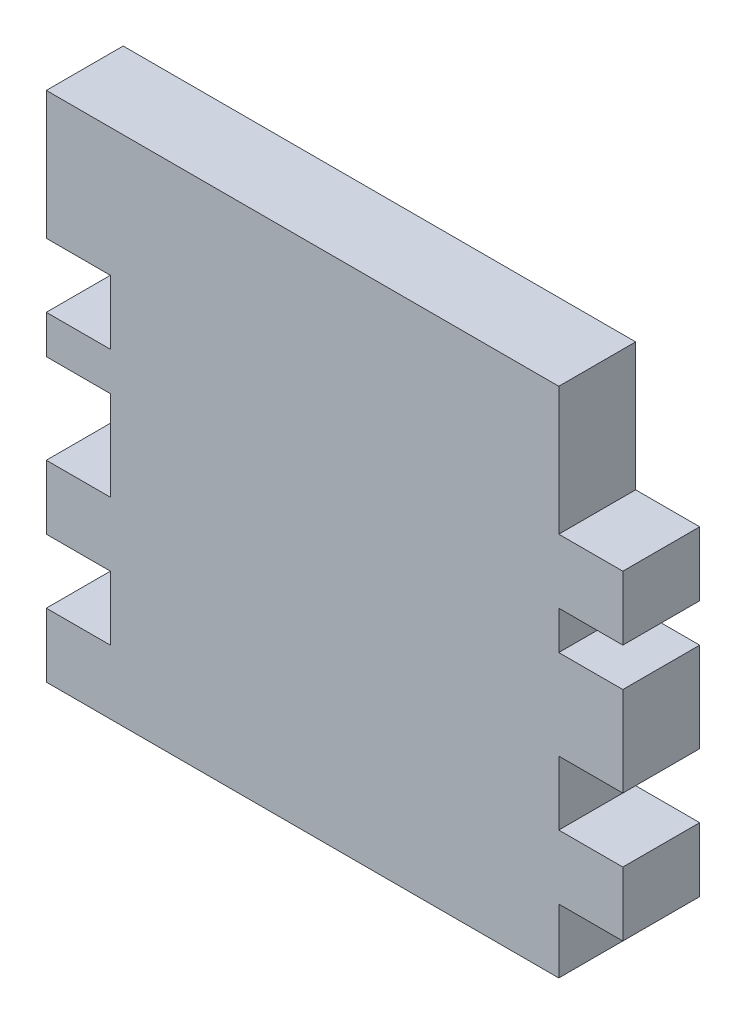
from build123d import *

# Parameters (mm, degrees)
SKETCH1_W           = 45
SKETCH1_H           = 40
BOSS_EXTRUDE1_DEPTH = 6
SKETCH2_W           = 5
SKETCH2_H           = 5
SKETCH2_H_2         = 7
CUT_EXTRUDE1_DEPTH  = 6
SKETCH3_W           = 5
SKETCH3_H           = 5
SKETCH3_H_2         = 7
CUT_EXTRUDE3_DEPTH  = 6
SKETCH3_4_W         = 5
SKETCH3_4_H         = 5
SKETCH3_4_H_2       = 7
BOSS_EXTRUDE3_DEPTH = 6
SKETCH3_5_W         = 5
SKETCH3_5_H         = 10
SKETCH3_5_H_2       = 3
SKETCH3_5_H_3       = 5
CUT_EXTRUDE4_DEPTH  = 6
SKETCH4_W           = 5
SKETCH4_H           = 2
CUT_EXTRUDE10_DEPTH = 10
SKETCH5_W           = 5
SKETCH5_H           = 5
BOSS_EXTRUDE4_DEPTH = 6


with BuildPart() as part:
    # Sketch1 → Boss-Extrude1 (new body)
    with BuildSketch(Plane.XY):
        with Locations((4.06626506, -2.515060241)):
            Rectangle(SKETCH1_W, SKETCH1_H)
    extrude(amount=BOSS_EXTRUDE1_DEPTH)

    # Sketch2 → Cut-Extrude1 (cut)
    with BuildSketch(Plane.XY.offset(6)):
        with Locations((-15.93373494, 4.984939759)):
            Rectangle(SKETCH2_W, SKETCH2_H)
        with Locations((-15.93373494, -6.015060241)):
            Rectangle(SKETCH2_W, SKETCH2_H_2)
        with Locations((-15.93373494, -15.015060241)):
            Rectangle(SKETCH2_W, SKETCH2_H)
    extrude(amount=-CUT_EXTRUDE1_DEPTH, mode=Mode.SUBTRACT)

    # Sketch3 → Cut-Extrude3 (cut)
    with BuildSketch(Plane.XY.offset(6)):
        with Locations((24.06626506, -15.015060241)):
            Rectangle(SKETCH3_W, SKETCH3_H)
        with Locations((24.06626506, -4.015060241)):
            Rectangle(SKETCH3_W, SKETCH3_H_2)
        with Locations((24.06626506, 4.984939759)):
            Rectangle(SKETCH3_W, SKETCH3_H)
    extrude(amount=-CUT_EXTRUDE3_DEPTH, mode=Mode.SUBTRACT)

    # Sketch3<4> → Boss-Extrude3 (add)
    with BuildSketch(Plane.XY.offset(6)):
        with Locations((24.06626506, 4.984939759)):
            Rectangle(SKETCH3_4_W, SKETCH3_4_H)
        with Locations((24.06626506, -4.015060241)):
            Rectangle(SKETCH3_4_W, SKETCH3_4_H_2)
        with Locations((24.06626506, -15.015060241)):
            Rectangle(SKETCH3_4_W, SKETCH3_4_H)
    extrude(amount=-BOSS_EXTRUDE3_DEPTH)

    # Sketch3<5> → Cut-Extrude4 (cut)
    with BuildSketch(Plane.XY.offset(6)):
        with Locations((24.06626506, 12.484939759)):
            Rectangle(SKETCH3_5_W, SKETCH3_5_H)
        with Locations((24.06626506, 0.984939759)):
            Rectangle(SKETCH3_5_W, SKETCH3_5_H_2)
        with Locations((24.06626506, -10.015060241)):
            Rectangle(SKETCH3_5_W, SKETCH3_5_H_3)
        with Locations((24.06626506, -20.015060241)):
            Rectangle(SKETCH3_5_W, SKETCH3_5_H_3)
    extrude(amount=-CUT_EXTRUDE4_DEPTH, mode=Mode.SUBTRACT)

    # Sketch4 → Cut-Extrude10 (cut)
    with BuildSketch(Plane.XY.offset(6)):
        with Locations((-15.93373494, -1.515060241)):
            Rectangle(SKETCH4_W, SKETCH4_H)
    extrude(amount=-CUT_EXTRUDE10_DEPTH, mode=Mode.SUBTRACT)

    # Sketch5 → Boss-Extrude4 (add)
    with BuildSketch(Plane.XY.offset(6)):
        with Locations((-15.93373494, -10.015060241)):
            Rectangle(SKETCH5_W, SKETCH5_H)
    extrude(amount=-BOSS_EXTRUDE4_DEPTH)


solid = part.part
